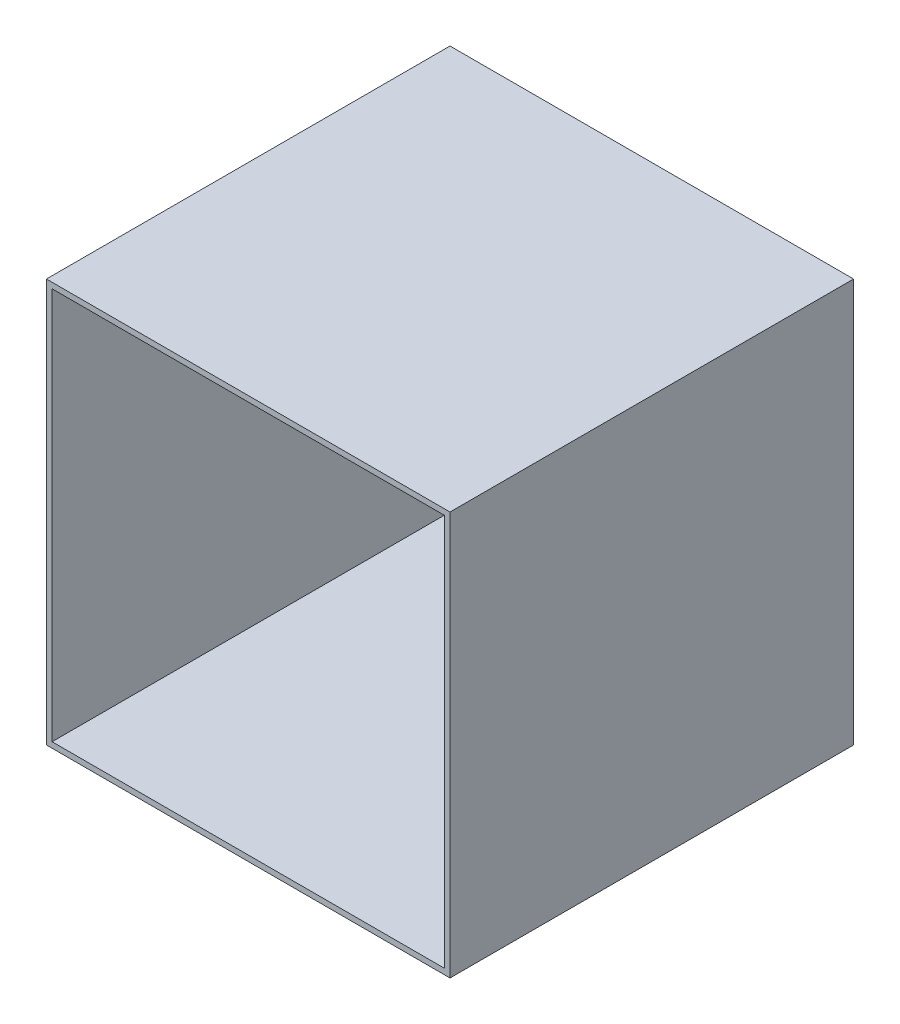
from build123d import *

# Parameters (mm, degrees)
SKETCH1_W           = 25
SKETCH1_H           = 25
SKETCH1_W_2         = 24.3
SKETCH1_H_2         = 24.3
BOSS_EXTRUDE1_DEPTH = 25


with BuildPart() as part:
    # Sketch1 → Boss-Extrude1 (new body)
    with BuildSketch(Plane.XY):
        Rectangle(SKETCH1_W, SKETCH1_H)
        Rectangle(SKETCH1_W_2, SKETCH1_H_2, mode=Mode.SUBTRACT)
    extrude(amount=BOSS_EXTRUDE1_DEPTH)


solid = part.part
